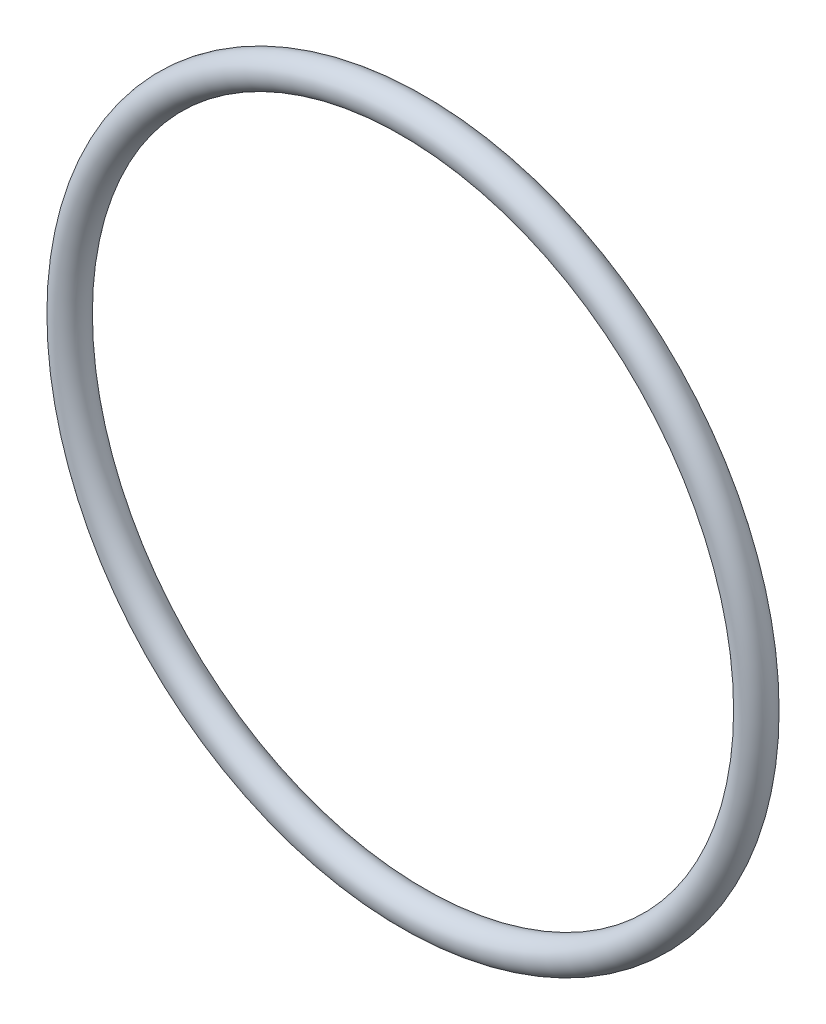
from build123d import *

# Parameters (mm, degrees)
ESBO_O2_R = 1.5


with BuildPart() as part:
    # Esboço2 → Revolução1 (revolve)
    with BuildSketch(Plane(origin=(0, 0, 0), x_dir=(0, 0, -1), z_dir=(1, 0, 0)), mode=Mode.PRIVATE) as revolu_o1_sk:
        with Locations((0, -0.5)):
            Circle(ESBO_O2_R)
    revolve(revolu_o1_sk.sketch.rotate(Axis((0, -32.5, -88.99), (0, 0, 1)), 90), axis=Axis((0, -32.5, -88.99), (0, 0, 1)))


solid = part.part
